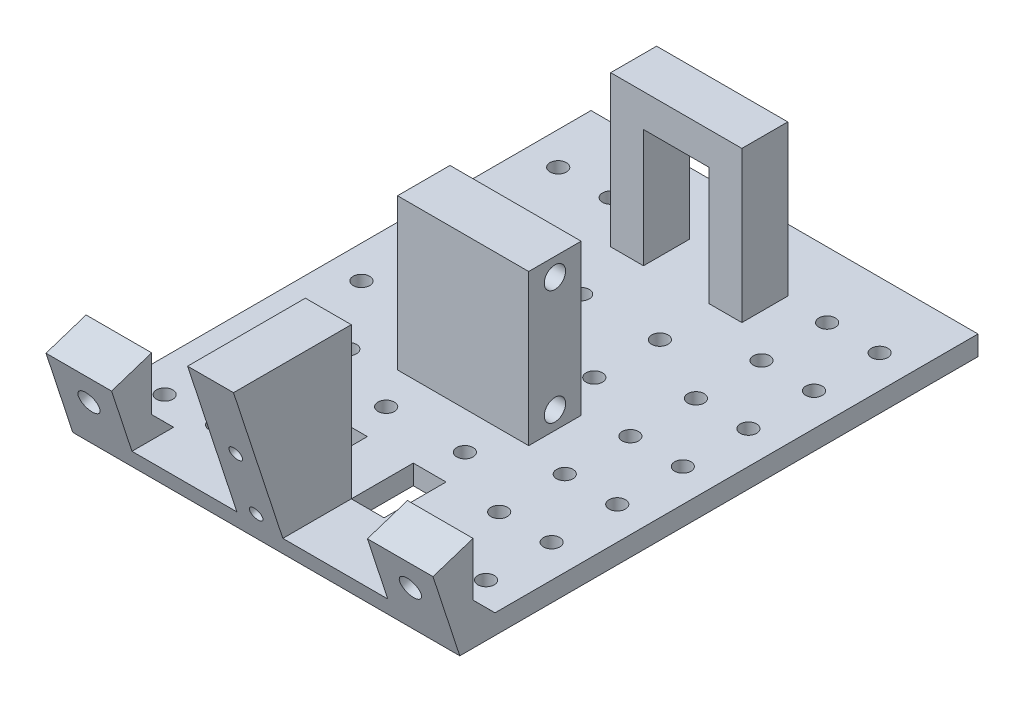
from build123d import *

# Parameters (mm, degrees)
SALIENTE_EXTRUIR1_DEPTH = 3
SKETCH1_W               = 20
SKETCH1_H               = 7
SKETCH1_H_2             = 8
SKETCH1_W_2             = 7
SKETCH1_H_3             = 38.5
BOSS_EXTRUDE1_DEPTH     = 23
CUT_EXTRUDE1_DEPTH      = 85.65548432
SKETCH3_R               = 1.625
CUT_EXTRUDE2_DEPTH      = 73.427902257
SKETCH4_R               = 1
CUT_EXTRUDE3_DEPTH      = 4
CORTAR_EXTRUIR1_DEPTH   = 10
CORTAR_EXTRUIR2_REACH   = 71.098
CROQUIS4_R              = 1.25
CORTAR_EXTRUIR3_DEPTH   = 3
BOSS_EXTRUDE2_DEPTH     = 20
SALIENTE_EXTRUIR2_DEPTH = 10
CORTAR_EXTRUIR4_REACH   = 91.44
CROQUIS7_R              = 1.625
CORTAR_EXTRUIR5_START   = -6.425484
CORTAR_EXTRUIR5_DEPTH   = 4
SALIENTE_EXTRUIR3_DEPTH = 10
CORTAR_EXTRUIR6_REACH   = 91.44
CROQUIS10_R             = 1.625
CORTAR_EXTRUIR7_START   = -2.42548
CORTAR_EXTRUIR7_DEPTH   = 4


with BuildPart() as part:
    # Croquis1 → Saliente-Extruir1 (new body)
    with BuildSketch(Plane(origin=(0, 0, 0), x_dir=(1, 0, 0), z_dir=(0, 1, 0))):
        Polygon((-29.5, 32.640625), (29.5, 32.640625), (29.5, -47.359375), (8.5, -47.359375), (8.5, -27.453125), (3.5, -27.453125), (3.5, -47.359375), (-3.5, -47.359375), (-3.5, -27.453125), (-8.5, -27.453125), (-8.5, -47.359375), (-29.5, -47.359375), align=None)
    extrude(amount=SALIENTE_EXTRUIR1_DEPTH)

    # Sketch1 → Boss-Extrude1 (add)
    with BuildSketch(Plane(origin=(0, 3, 0), x_dir=(1, 0, 0), z_dir=(0, 1, 0))):
        with Locations((0, 19.640625)):
            Rectangle(SKETCH1_W, SKETCH1_H)
        with Locations((0, -12.359375)):
            Rectangle(SKETCH1_W, SKETCH1_H_2)
        with Locations((0, -35.609375)):
            Rectangle(SKETCH1_W_2, SKETCH1_H_3)
    extrude(amount=BOSS_EXTRUDE1_DEPTH)

    # Sketch2 → Cut-Extrude1 (cut, through all)
    with BuildSketch(Plane(origin=(29.5, 0, 0), x_dir=(0, 0, -1), z_dir=(1, 0, 0))):
        Polygon((-54.859375, 26), (-46.359375, 0), (-47.359375, 0), (-47.359375, 3), (-54.859375, 3), align=None)
    extrude(amount=-CUT_EXTRUDE1_DEPTH, mode=Mode.SUBTRACT)

    # Sketch3 → Cut-Extrude2 (cut, through all)
    with BuildSketch(Plane.ZY.offset(10)):
        with Locations((12.359375, 5.75)):
            Circle(SKETCH3_R)
        with Locations((12.359375, 23.25)):
            Circle(SKETCH3_R)
    extrude(amount=-CUT_EXTRUDE2_DEPTH, mode=Mode.SUBTRACT)

    # Sketch4 → Cut-Extrude3 (cut)
    with BuildSketch(Plane(origin=(0, -13.692511694, 41.882976946), x_dir=(1, 0, 0), z_dir=(0, -0.31073885630742226, 0.9504953251756452))):
        with Locations(Location((0, 19.405659167, 0), (0, 0, 270))):
            Circle(SKETCH4_R)
        with Locations(Location((0, 29.405659167, 0), (0, 0, 270))):
            Circle(SKETCH4_R)
    extrude(amount=-CUT_EXTRUDE3_DEPTH, mode=Mode.SUBTRACT)

    # Croquis2 → Cortar-Extruir1 (cut)
    with BuildSketch(Plane(origin=(0, 0, -23.140625), x_dir=(-1, 0, 0), z_dir=(0, 0, -1))):
        Polygon((-5, 6), (-5, 3), (5, 3), (5, 6), (5, 21), (-5, 21), align=None)
    extrude(amount=-CORTAR_EXTRUIR1_DEPTH, mode=Mode.SUBTRACT)

    # Croquis3 → Cortar-Extruir2 (cut, up to next)
    with BuildSketch(Plane.ZY.offset(3.5), mode=Mode.PRIVATE) as cortar_extruir2_sk1:
        Polygon((21.90625, 3), (36.90625, 3), (36.90625, 26), (21.90625, 26), (16.359375, 26), (16.359375, 3), align=None)
    cortar_extruir2_tool1 = extrude(cortar_extruir2_sk1.sketch, amount=-CORTAR_EXTRUIR2_REACH, mode=Mode.PRIVATE) & part.part
    add(cortar_extruir2_tool1.solids().sort_by_distance((-3.5, 14.5, 26.632812))[0], mode=Mode.SUBTRACT)

    # Croquis4 → Cortar-Extruir3 (cut)
    with BuildSketch(Plane.XZ):
        with Locations(Location((-24.5, -22.640625, 0), (0, 0, 270))):
            Circle(CROQUIS4_R)
        with Locations(Location((-16.5, -22.640625, 0), (0, 0, 270))):
            Circle(CROQUIS4_R)
        with Locations(Location((-16.5, -12.640625, 0), (0, 0, 270))):
            Circle(CROQUIS4_R)
        with Locations(Location((-16.5, -2.640625, 0), (0, 0, 270))):
            Circle(CROQUIS4_R)
        with Locations(Location((-16.5, 7.359375, 0), (0, 0, 270))):
            Circle(CROQUIS4_R)
        with Locations(Location((-16.5, 17.359375, 0), (0, 0, 270))):
            Circle(CROQUIS4_R)
        with Locations(Location((-16.5, 27.359375, 0), (0, 0, 270))):
            Circle(CROQUIS4_R)
        with Locations(Location((-16.5, 37.359375, 0), (0, 0, 270))):
            Circle(CROQUIS4_R)
        with Locations(Location((-24.5, -12.640625, 0), (0, 0, 270))):
            Circle(CROQUIS4_R)
        with Locations(Location((-24.5, -2.640625, 0), (0, 0, 270))):
            Circle(CROQUIS4_R)
        with Locations(Location((-24.5, 7.359375, 0), (0, 0, 270))):
            Circle(CROQUIS4_R)
        with Locations(Location((-24.5, 17.359375, 0), (0, 0, 270))):
            Circle(CROQUIS4_R)
        with Locations(Location((-24.5, 27.359375, 0), (0, 0, 270))):
            Circle(CROQUIS4_R)
        with Locations(Location((-24.5, 37.359375, 0), (0, 0, 270))):
            Circle(CROQUIS4_R)
        with Locations(Location((16.5, 37.359375, 0), (0, 0, 270))):
            Circle(CROQUIS4_R)
        with Locations(Location((24.5, 37.359375, 0), (0, 0, 270))):
            Circle(CROQUIS4_R)
        with Locations(Location((16.5, 27.359375, 0), (0, 0, 270))):
            Circle(CROQUIS4_R)
        with Locations(Location((24.5, 27.359375, 0), (0, 0, 270))):
            Circle(CROQUIS4_R)
        with Locations(Location((16.5, 17.359375, 0), (0, 0, 270))):
            Circle(CROQUIS4_R)
        with Locations(Location((24.5, 17.359375, 0), (0, 0, 270))):
            Circle(CROQUIS4_R)
        with Locations(Location((24.5, 7.359375, 0), (0, 0, 270))):
            Circle(CROQUIS4_R)
        with Locations(Location((16.5, 7.359375, 0), (0, 0, 270))):
            Circle(CROQUIS4_R)
        with Locations(Location((16.5, -2.640625, 0), (0, 0, 270))):
            Circle(CROQUIS4_R)
        with Locations(Location((24.5, -2.640625, 0), (0, 0, 270))):
            Circle(CROQUIS4_R)
        with Locations(Location((24.5, -12.640625, 0), (0, 0, 270))):
            Circle(CROQUIS4_R)
        with Locations(Location((16.5, -12.640625, 0), (0, 0, 270))):
            Circle(CROQUIS4_R)
        with Locations(Location((16.5, -22.640625, 0), (0, 0, 270))):
            Circle(CROQUIS4_R)
        with Locations(Location((24.5, -22.640625, 0), (0, 0, 270))):
            Circle(CROQUIS4_R)
        with Locations(Location((6, 22.084531493, 0), (0, 0, 270))):
            Circle(CROQUIS4_R)
        with Locations(Location((-6, 22.084531493, 0), (0, 0, 270))):
            Circle(CROQUIS4_R)
        with Locations(Location((6, 2.359375, 0), (0, 0, 270))):
            Circle(CROQUIS4_R)
        with Locations(Location((-6, 2.359375, 0), (0, 0, 270))):
            Circle(CROQUIS4_R)
        with Locations(Location((-6, -7.640625, 0), (0, 0, 270))):
            Circle(CROQUIS4_R)
        with Locations(Location((6, -7.640625, 0), (0, 0, 270))):
            Circle(CROQUIS4_R)
    extrude(amount=-CORTAR_EXTRUIR3_DEPTH, mode=Mode.SUBTRACT)

    # Sketch5 → Boss-Extrude2 (add)
    with BuildSketch(Plane(origin=(-8.5, 0, 0), x_dir=(0, 0, -1), z_dir=(1, 0, 0))):
        Polygon((-36.90625, 3), (-36.90625, 0), (-46.359375, 0), (-47.340144231, 3), align=None)
    extrude(amount=BOSS_EXTRUDE2_DEPTH)

    # Croquis6 → Saliente-Extruir2 (add)
    with BuildSketch(Plane.ZY.offset(29.5)):
        Polygon((44.340144231, 3), (47.340144231, 3), (50.447532794, 12.504953252), (44.340144231, 14.501599513), (44.340144231, 6.347956044), align=None)
        Polygon((40.990144231, 3), (44.340144231, 3), (44.340144231, 6.347956044), align=None)
    extrude(amount=-SALIENTE_EXTRUIR2_DEPTH)

    # Cortar-Extruir4: up to this plane
    cortar_extruir4_end = Plane(origin=(-19.5, 0, 44.340144231), z_dir=(0, 0, -1))
    # Croquis7 → Cortar-Extruir4 (cut, up to the surface)
    with BuildSketch(Plane(origin=(0, -13.692511694, 41.882976946), x_dir=(1, 0, 0), z_dir=(0, -0.31073885630742226, 0.9504953251756452)), mode=Mode.PRIVATE) as cortar_extruir4_sk1:
        with Locations(Location((-24.5, 22.561908251, 0), (0, 0, 270))):
            Circle(CROQUIS7_R)
    cortar_extruir4_tool1 = split(extrude(cortar_extruir4_sk1.sketch, amount=-CORTAR_EXTRUIR4_REACH, mode=Mode.PRIVATE), bisect_by=cortar_extruir4_end, keep=Keep.BOTH, mode=Mode.PRIVATE)
    add(cortar_extruir4_tool1.solids().sort_by_distance((-24.5, 7.752477, 48.893839))[0], mode=Mode.SUBTRACT)

    # Croquis8 → Cortar-Extruir5 (cut)
    with BuildSketch(Plane(origin=(0, -13.692511694, 41.882976946), x_dir=(1, 0, 0), z_dir=(0, -0.31073885630742226, 0.9504953251756452)).offset(CORTAR_EXTRUIR5_START)):
        Polygon((-22.91228676, 19.811908251), (-21.324573519, 22.561908251), (-22.91228676, 25.311908251), (-26.08771324, 25.311908251), (-27.675426481, 22.561908251), (-26.08771324, 19.811908251), align=None)
    extrude(amount=CORTAR_EXTRUIR5_DEPTH, mode=Mode.SUBTRACT)

    # Croquis9 → Saliente-Extruir3 (add)
    with BuildSketch(Plane(origin=(29.5, 0, 0), x_dir=(0, 0, -1), z_dir=(1, 0, 0))):
        Polygon((-50.447532794, 12.504953252), (-47.340144231, 3), (-44.340144231, 3), (-44.340144231, 6.347956044), (-44.340144231, 14.501599513), align=None)
        Polygon((-44.340144231, 6.347956044), (-44.340144231, 3), (-40.990144231, 3), align=None)
    extrude(amount=-SALIENTE_EXTRUIR3_DEPTH)

    # Cortar-Extruir6: up to this plane
    cortar_extruir6_end = Plane(origin=(19.5, 0, 44.340144231), z_dir=(0, 0, 1))
    # Croquis10 → Cortar-Extruir6 (cut, up to the surface)
    with BuildSketch(Plane(origin=(0, -13.692511694, 41.882976946), x_dir=(1, 0, 0), z_dir=(0, -0.31073885630742226, 0.9504953251756452)), mode=Mode.PRIVATE) as cortar_extruir6_sk1:
        with Locations(Location((24.5, 22.561908251, 0), (0, 0, 270))):
            Circle(CROQUIS10_R)
    cortar_extruir6_tool1 = split(extrude(cortar_extruir6_sk1.sketch, amount=-CORTAR_EXTRUIR6_REACH, mode=Mode.PRIVATE), bisect_by=cortar_extruir6_end, keep=Keep.BOTH, mode=Mode.PRIVATE)
    add(cortar_extruir6_tool1.solids().sort_by_distance((24.5, 7.752477, 48.893839))[0], mode=Mode.SUBTRACT)

    # Croquis11 → Cortar-Extruir7 (cut)
    with BuildSketch(Plane(origin=(0, -13.692511694, 41.882976946), x_dir=(1, 0, 0), z_dir=(0, -0.31073885630742226, 0.9504953251756452)).offset(CORTAR_EXTRUIR7_START)):
        Polygon((26.08771324, 19.811908251), (27.675426481, 22.561908251), (26.08771324, 25.311908251), (22.91228676, 25.311908251), (21.324573519, 22.561908251), (22.91228676, 19.811908251), align=None)
    extrude(amount=-CORTAR_EXTRUIR7_DEPTH, mode=Mode.SUBTRACT)


solid = part.part
